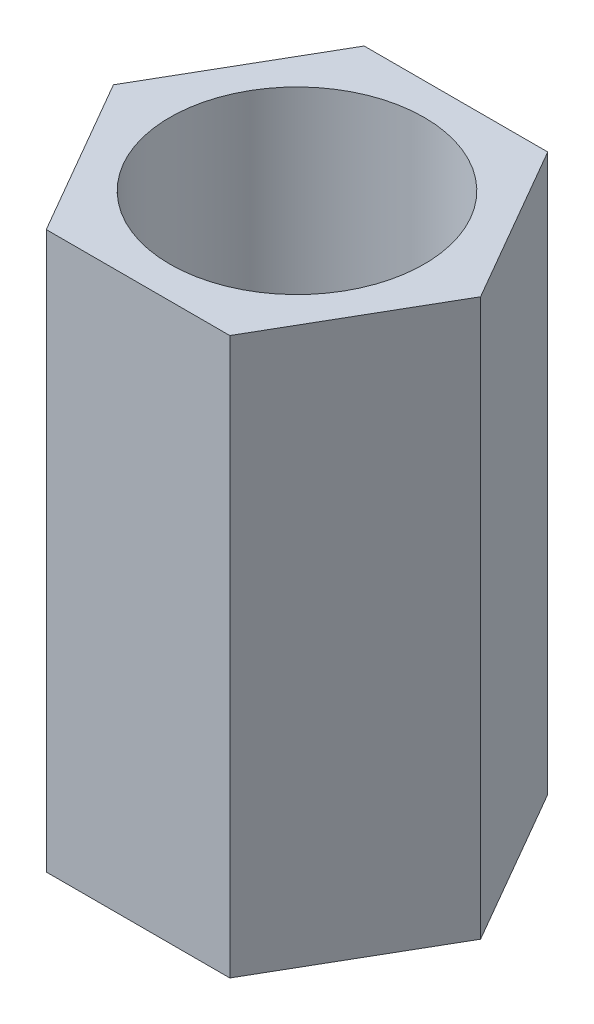
from build123d import *

# Parameters (mm, degrees)
SKETCH_1_R      = 1.6
EXTRUDE_2_DEPTH = 7


with BuildPart() as part:
    # 스케치1 → 보스-돌출2 (new body)
    with BuildSketch(Plane(origin=(0, 0, 0), x_dir=(1, 0, 0), z_dir=(0, 1, 0))):
        Polygon((2.309401077, 0), (1.154700538, 2), (-1.154700538, 2), (-2.309401077, 0), (-1.154700538, -2), (1.154700538, -2), align=None)
        with Locations(Location((0, 0, 0), (0, 0, 270))):
            Circle(SKETCH_1_R, mode=Mode.SUBTRACT)
    extrude(amount=EXTRUDE_2_DEPTH)


solid = part.part
